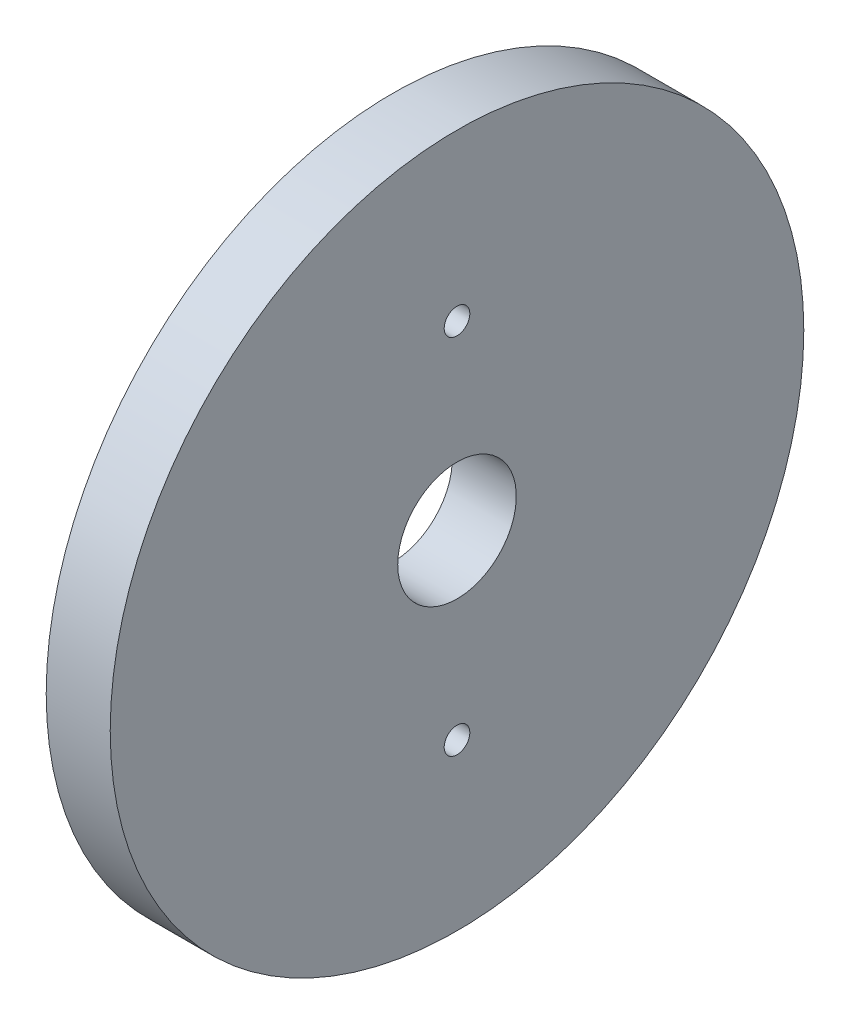
from build123d import *

# Parameters (mm, degrees)
AXIAL_PROFILE_MM_W     = 12
AXIAL_PROFILE_MM_H     = 53.8875
AXIAL_HOLES_DEPTH      = 96.448886845
AXIAL_HOLES_DEPTH_BACK = 96.448886845
SKETCH2_R              = 2.4


with BuildPart() as part:
    # Axial profile (mm) → Full revolution (revolve)
    with BuildSketch(Plane.XY, mode=Mode.PRIVATE) as full_revolution_sk:
        with Locations((19.7, 38.05625)):
            Rectangle(AXIAL_PROFILE_MM_W, AXIAL_PROFILE_MM_H)
    revolve(full_revolution_sk.sketch.rotate(Axis((-110, 0, 0), (1, 0, 0)), 90), axis=Axis((-110, 0, 0), (1, 0, 0)))

    # Sketch2 → Axial holes (cut, two sides: drawn at the far end of the back side and taken through both)
    with BuildSketch(Plane(origin=(0, 0, 0), x_dir=(0, 0, -1), z_dir=(1, 0, 0)).offset(-AXIAL_HOLES_DEPTH_BACK)):
        with Locations((0, 34)):
            Circle(SKETCH2_R)
        with Locations((0, -34)):
            Circle(SKETCH2_R)
    extrude(amount=AXIAL_HOLES_DEPTH + AXIAL_HOLES_DEPTH_BACK, mode=Mode.SUBTRACT)


solid = part.part
